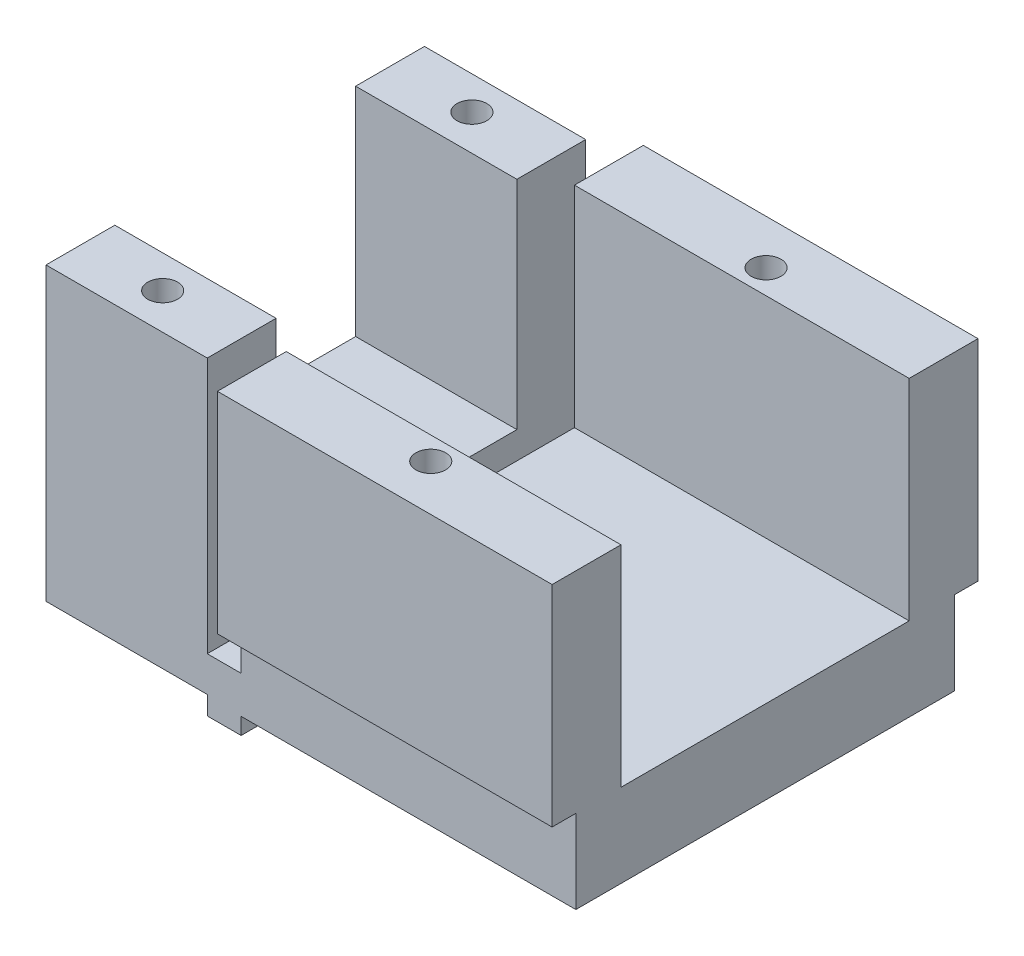
from build123d import *

# Parameters (mm, degrees)
SKETCH1_W            = 11.9
SKETCH1_H            = 27.93
BOSS_EXTRUDE1_DEPTH  = 1.27
SKETCH1_3_W          = 11.9
SKETCH1_3_H          = 5.08
BOSS_EXTRUDE2_DEPTH  = 16.77
SKETCH2_R            = 1.1
CUT_EXTRUDE1_DEPTH   = 10.16
SKETCH3_R            = 1.1
CUT_EXTRUDE2_DEPTH   = 10.16
SKETCH4_W            = 27.93
SKETCH4_H            = 1.48
BOSS_EXTRUDE4_DEPTH  = 11.9
SKETCH6_W            = 27.93
SKETCH6_H            = 2.75
BOSS_EXTRUDE5_DEPTH  = 11.9
SKETCH7_W            = 27.93
SKETCH7_H            = 2.75
BOSS_EXTRUDE6_DEPTH  = 2.5
BOSS_EXTRUDE7_DEPTH  = 2.5
BOSS_EXTRUDE13_START = 0.5
SKETCH19_W           = 11.9
SKETCH19_H           = 5.08
SKETCH19_R           = 1.1
BOSS_EXTRUDE13_DEPTH = 0.5
BOSS_EXTRUDE14_DEPTH = 24.7
SKETCH21_W           = 24.7
SKETCH21_H           = 27.93
BOSS_EXTRUDE16_DEPTH = 0.5
SKETCH23_W           = 24.7
SKETCH23_H           = 5.08
BOSS_EXTRUDE17_DEPTH = 15.5
SKETCH24_R           = 1.1
CUT_EXTRUDE3_DEPTH   = 10


with BuildPart() as part:
    # Sketch1 → Boss-Extrude1 (new body)
    with BuildSketch(Plane(origin=(0, 0, 0), x_dir=(1, 0, 0), z_dir=(0, 1, 0))):
        with Locations((5.95, 8.25)):
            Rectangle(SKETCH1_W, SKETCH1_H)
    extrude(amount=BOSS_EXTRUDE1_DEPTH)

    # Sketch1<3> → Boss-Extrude2 (add)
    with BuildSketch(Plane(origin=(0, 0, 0), x_dir=(1, 0, 0), z_dir=(0, 1, 0))):
        with Locations((5.95, 19.675)):
            Rectangle(SKETCH1_3_W, SKETCH1_3_H)
        with Locations((5.95, -3.175)):
            Rectangle(SKETCH1_3_W, SKETCH1_3_H)
    extrude(amount=BOSS_EXTRUDE2_DEPTH)

    # Sketch2 → Cut-Extrude1 (cut)
    with BuildSketch(Plane(origin=(0, 16.77, 0), x_dir=(1, 0, 0), z_dir=(0, 1, 0))):
        with Locations((5.95, 19.765430595)):
            Circle(SKETCH2_R)
    extrude(amount=-CUT_EXTRUDE1_DEPTH, mode=Mode.SUBTRACT)

    # Sketch3 → Cut-Extrude2 (cut)
    with BuildSketch(Plane(origin=(0, 16.77, 0), x_dir=(1, 0, 0), z_dir=(0, 1, 0))):
        with Locations((5.95, -3.056330688)):
            Circle(SKETCH3_R)
    extrude(amount=-CUT_EXTRUDE2_DEPTH, mode=Mode.SUBTRACT)

    # Sketch4 → Boss-Extrude4 (add)
    with BuildSketch(Plane(origin=(11.9, 0, 0), x_dir=(0, 0, -1), z_dir=(1, 0, 0))):
        with Locations((8.25, -0.74)):
            Rectangle(SKETCH4_W, SKETCH4_H)
    extrude(amount=-BOSS_EXTRUDE4_DEPTH)

    # Sketch6 → Boss-Extrude5 (add)
    with BuildSketch(Plane(origin=(11.9, 0, 0), x_dir=(0, 0, -1), z_dir=(1, 0, 0))):
        with Locations((8.25, -2.855)):
            Rectangle(SKETCH6_W, SKETCH6_H)
    extrude(amount=-BOSS_EXTRUDE5_DEPTH)

    # Sketch7 → Boss-Extrude6 (add)
    with BuildSketch(Plane(origin=(11.9, 0, 0), x_dir=(0, 0, -1), z_dir=(1, 0, 0))):
        with Locations((8.25, -4.23)):
            Rectangle(SKETCH7_W, SKETCH7_H)
    extrude(amount=BOSS_EXTRUDE6_DEPTH)

    # Sketch8 → Boss-Extrude7 (add)
    with BuildSketch(Plane(origin=(11.9, 0, 0), x_dir=(0, 0, -1), z_dir=(1, 0, 0))):
        Polygon((22.215, -1.63), (-0.635, -1.63), (-5.715, -1.63), (-5.715, -2.855), (22.215, -2.855), align=None)
    extrude(amount=BOSS_EXTRUDE7_DEPTH)

    # Sketch19 → Boss-Extrude13 (add)
    # profile 1 of 2: a face of its own
    with BuildSketch(Plane(origin=(0, 16.77, 0), x_dir=(1, 0, 0), z_dir=(0, 1, 0)).offset(BOSS_EXTRUDE13_START)):
        with Locations((5.95, 19.675)):
            Rectangle(SKETCH19_W, SKETCH19_H)
        with Locations((5.95, 19.765430595)):
            Circle(SKETCH19_R, mode=Mode.SUBTRACT)
    # profile 2 of 2: a face of its own
    with BuildSketch(Plane(origin=(0, 16.77, 0), x_dir=(1, 0, 0), z_dir=(0, 1, 0)).offset(BOSS_EXTRUDE13_START)):
        with Locations((5.95, -3.175)):
            Rectangle(SKETCH19_W, SKETCH19_H)
        with Locations((5.95, -3.056330688)):
            Circle(SKETCH19_R, mode=Mode.SUBTRACT)
    extrude(amount=-BOSS_EXTRUDE13_DEPTH)

    # Sketch20 → Boss-Extrude14 (add)
    with BuildSketch(Plane(origin=(14.4, 0, 0), x_dir=(0, 0, -1), z_dir=(1, 0, 0))):
        Polygon((-5.715, -1.63), (-5.715, -4.38), (22.215, -4.38), (22.215, -3.6175), (22.215, 1.27), (-5.715, 1.27), align=None)
    extrude(amount=BOSS_EXTRUDE14_DEPTH)

    # Sketch21 → Boss-Extrude16 (add)
    with BuildSketch(Plane(origin=(0, 1.27, 0), x_dir=(1, 0, 0), z_dir=(0, 1, 0))):
        with Locations((26.75, 8.25)):
            Rectangle(SKETCH21_W, SKETCH21_H)
    extrude(amount=BOSS_EXTRUDE16_DEPTH)

    # Sketch23 → Boss-Extrude17 (add)
    with BuildSketch(Plane(origin=(0, 1.77, 0), x_dir=(1, 0, 0), z_dir=(0, 1, 0))):
        with Locations((26.75, 21.425)):
            Rectangle(SKETCH23_W, SKETCH23_H)
        with Locations((26.75, -4.925)):
            Rectangle(SKETCH23_W, SKETCH23_H)
    extrude(amount=BOSS_EXTRUDE17_DEPTH)

    # Sketch24 → Cut-Extrude3 (cut)
    with BuildSketch(Plane(origin=(0, 17.27, 0), x_dir=(1, 0, 0), z_dir=(0, 1, 0))):
        with Locations((26.75, -4.069787702)):
            Circle(SKETCH24_R)
        with Locations((26.75, 20.675)):
            Circle(SKETCH24_R)
    extrude(amount=-CUT_EXTRUDE3_DEPTH, mode=Mode.SUBTRACT)


solid = part.part
